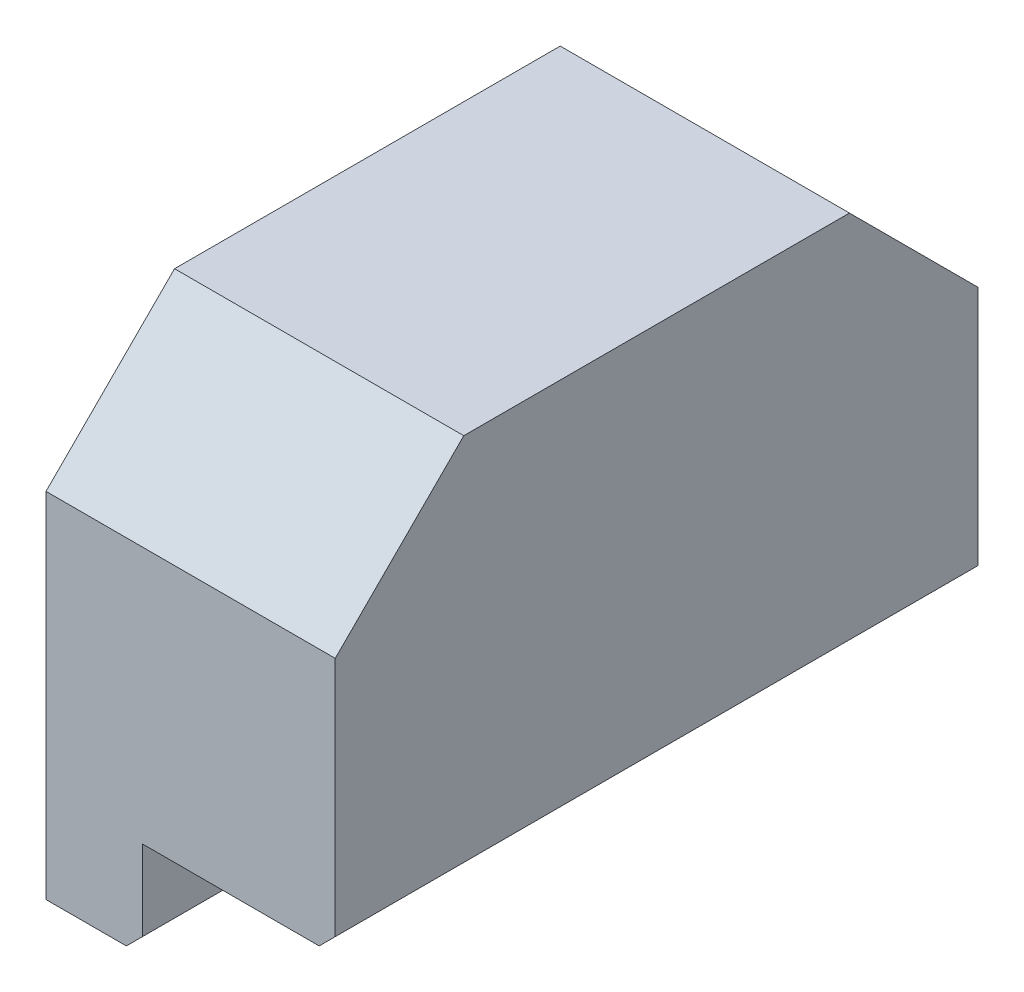
from build123d import *

# Parameters (mm, degrees)
EXTRUDE_1_DEPTH        = 20
SKETCH_6_R             = 5
SKETCH_6_R_2           = 2
CUT_EXTRUDE_2_DEPTH    = 2
CHAMFER_2_SIZE         = 4
CHAMFER_3_SIZE         = 0.5
HOLE_WIZARD_M3_1_D     = 2.5
HOLE_WIZARD_M3_1_DEPTH = 7.5
HOLE_WIZARD_M3_1_TIP   = 0.751075774


with BuildPart() as part:
    # 草图1 → 凸台-拉伸1 (new body)
    with BuildSketch(Plane.XY):
        Polygon((0, 3), (0, 0), (-3, 0), (-3, 15), (6, 15), (6, 3), align=None)
    extrude(amount=EXTRUDE_1_DEPTH)

    # 草图6 → 切除-拉伸2 (cut)
    with BuildSketch(Plane.ZY.offset(3)):
        with Locations(Location((10, 9, 0), (0, 0, 270))):
            Circle(SKETCH_6_R)
        with Locations(Location((10, 9, 0), (0, 0, 270))):
            Circle(SKETCH_6_R_2, mode=Mode.SUBTRACT)
    extrude(amount=-CUT_EXTRUDE_2_DEPTH, mode=Mode.SUBTRACT)

    # 倒角2
    chamfer_2_edges = [part.edges().sort_by_distance(p)[0] for p in [
        (1.5, 15, 20),
        (1.5, 15, 0),
    ]]
    chamfer(chamfer_2_edges, length=CHAMFER_2_SIZE)

    # 倒角3
    chamfer_3_edges = [part.edges().sort_by_distance(p)[0] for p in [
        (6, 3, 10),
        (0, 0, 10),
        (-3, 14, 10),
        (-3, 11, 10),
    ]]
    chamfer(chamfer_3_edges, length=CHAMFER_3_SIZE)

    # M3 螺纹孔1
    with Locations(Plane(origin=(0, 3, 0), x_dir=(-1, 0, 0), z_dir=(0, -1, 0))):
        with Locations((-2.5, -5), (-2.5, -15)):
            Hole(HOLE_WIZARD_M3_1_D / 2, depth=HOLE_WIZARD_M3_1_DEPTH)
            with Locations((0, 0, -(HOLE_WIZARD_M3_1_DEPTH + HOLE_WIZARD_M3_1_TIP / 2))):  # 118° drill point
                Cone(0, HOLE_WIZARD_M3_1_D / 2, HOLE_WIZARD_M3_1_TIP, mode=Mode.SUBTRACT)


solid = part.part
